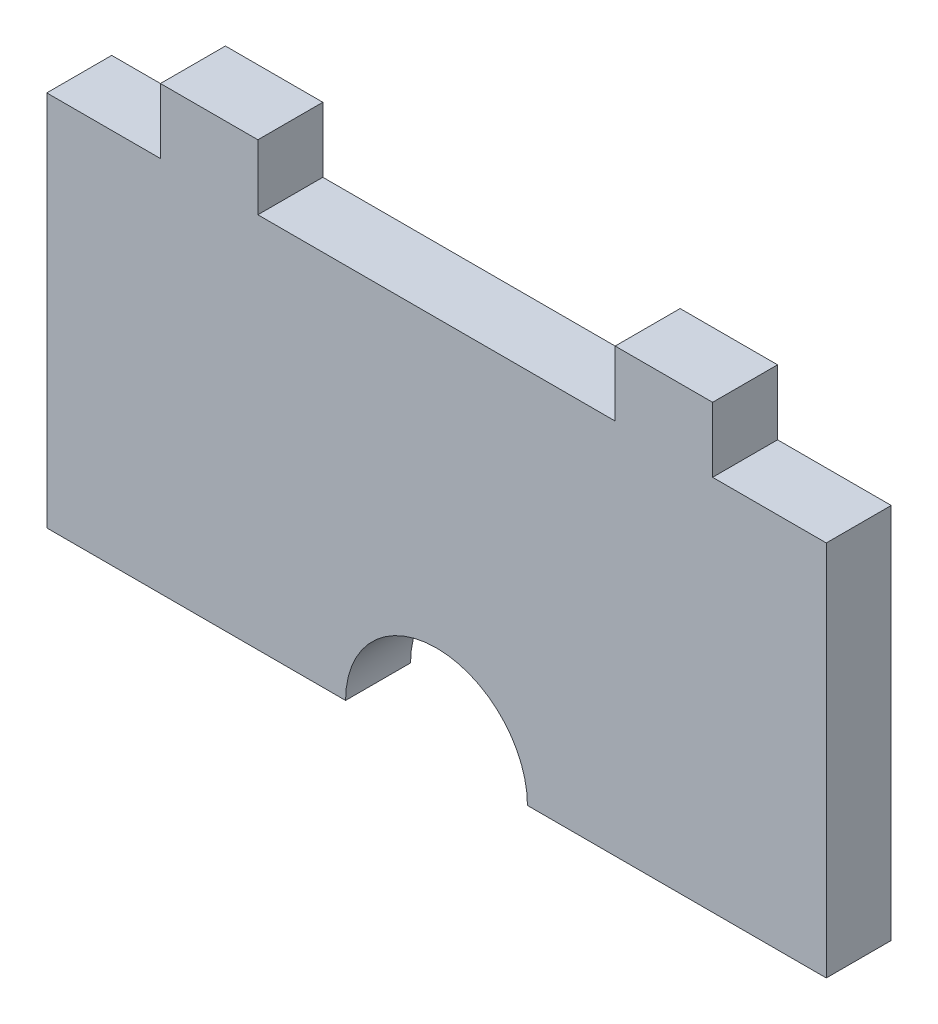
from build123d import *

# Parameters (mm, degrees)
EXTRUDE1_DEPTH     = 12.7
SKETCH2_R          = 17.78
CUT_EXTRUDE1_DEPTH = 242.3


with BuildPart() as part:
    # Sketch1 → Extrude1 (new body)
    with BuildSketch(Plane.XY):
        Polygon((-76.2, 215.9), (-53.975, 215.9), (-53.975, 228.6), (-34.925, 228.6), (-34.925, 215.9), (34.925, 215.9), (34.925, 228.6), (53.975, 228.6), (53.975, 215.9), (76.2, 215.9), (76.2, 142.24), (-76.2, 142.24), align=None)
    extrude(amount=-EXTRUDE1_DEPTH)

    # Sketch2 → Cut-Extrude1 (cut, through all)
    with BuildSketch(Plane.XY):
        with Locations((0, 142.24)):
            Circle(SKETCH2_R)
    extrude(amount=-CUT_EXTRUDE1_DEPTH, mode=Mode.SUBTRACT)


solid = part.part
